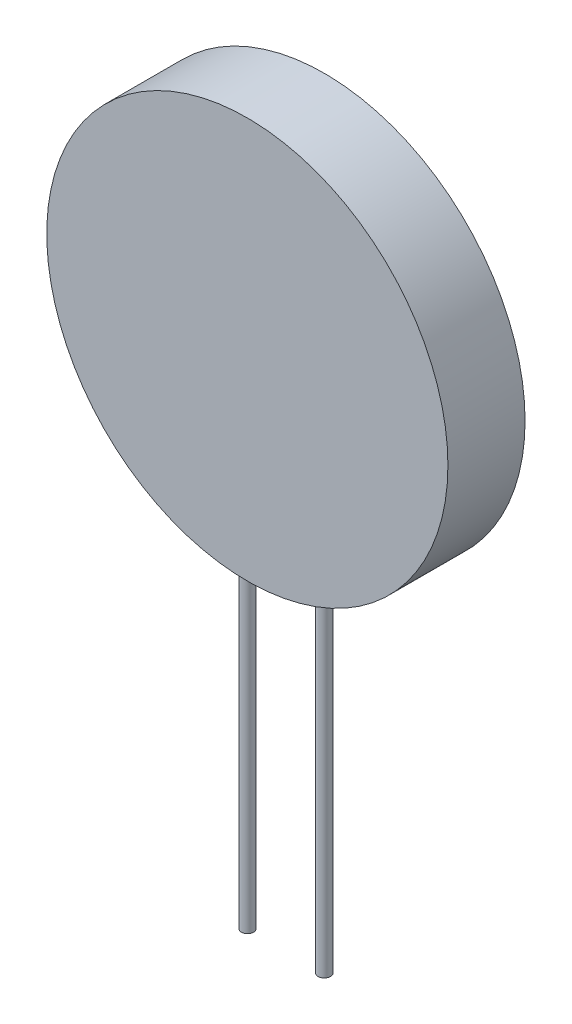
from build123d import *

# Parameters (mm, degrees)
SKETCH1_R           = 13
BOSS_EXTRUDE1_DEPTH = 2.5
SKETCH3_R           = 0.4


with BuildPart() as part:
    # Sketch1 → Boss-Extrude1 (new, symmetric)
    with BuildSketch(Plane.XY):
        Circle(SKETCH1_R)
    extrude(amount=BOSS_EXTRUDE1_DEPTH, both=True)

    # Sweep1: sweep along a path in Sketch2
    with BuildLine(Plane.XY) as sweep1_path:
        Line((-2.5, 0), (-2.5, -35))
    # Sketch3 → Sweep1 (sweep)
    with BuildSketch(Plane(origin=(0, 0, 0), x_dir=(1, 0, 0), z_dir=(0, 1, 0))):
        with Locations((-2.489602721, 0)):
            Circle(SKETCH3_R)
    sweep1 = sweep(path=sweep1_path.line)

    # Mirror1: Sweep1 across plane
    add(sweep1.mirror(Plane(origin=(0, 0, 0), x_dir=(0, 0, 1), z_dir=(1, 0, 0))))


solid = part.part
